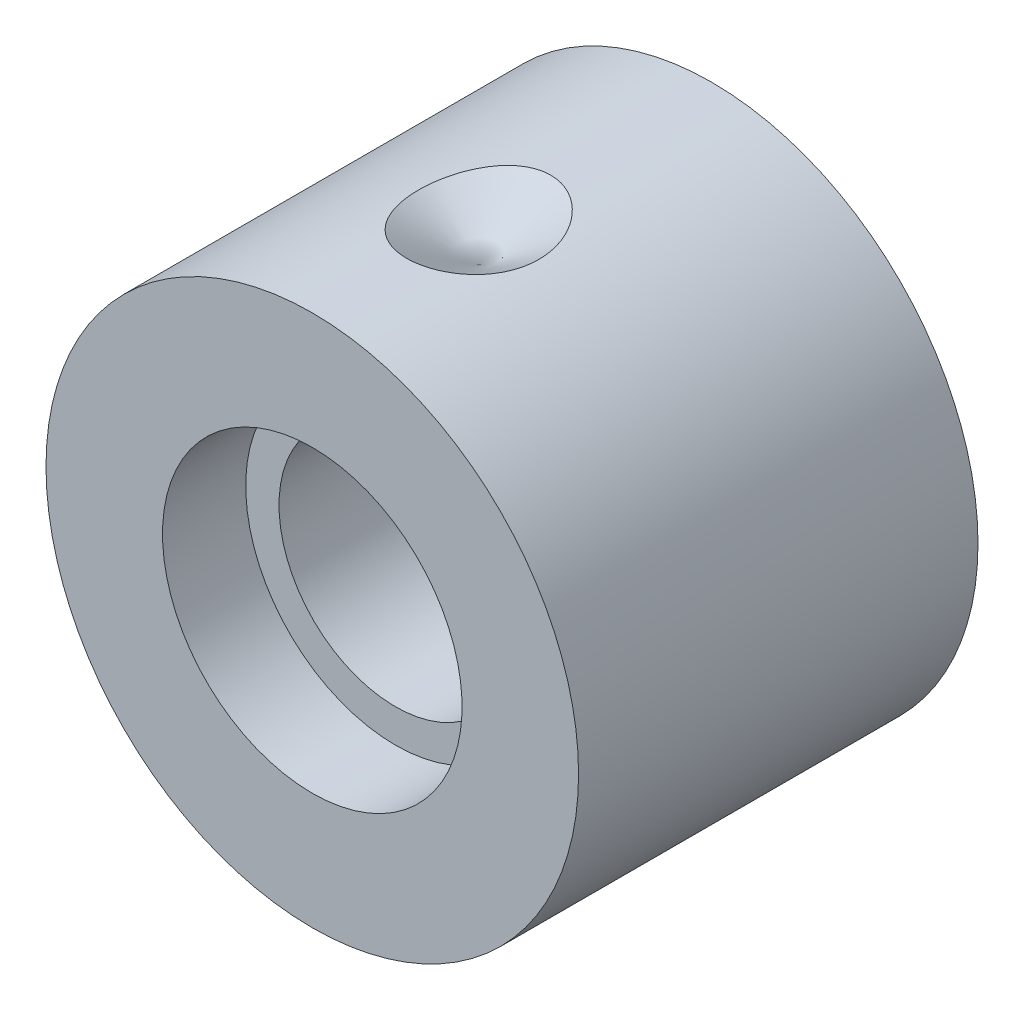
from build123d import *

# Parameters (mm, degrees)
HOLE_WIZARD_M16_1_D = 14


with BuildPart() as part:
    # 草圖1 → 旋轉1 (revolve)
    with BuildSketch(Plane(origin=(0, 0, 0), x_dir=(0, 0, -1), z_dir=(1, 0, 0))):
        Polygon((5, 0), (5, 9), (0, 9), (0, 16), (24, 16), (24, 0), align=None)
    revolve(axis=Axis((0, 0, -24), (0, 0, 1)))

    # 草圖2 → 除料-旋轉1 (revolve, cut)
    with BuildSketch(Plane(origin=(0, 0, 0), x_dir=(0, 0, -1), z_dir=(1, 0, 0))):
        Polygon((3.7183072, 19.324474935), (10, 19.324474935), (10, 13.5), (3.7183072, 17.126737029), align=None)
    revolve(axis=Axis((0, 11.187716982, -10), (0, 1, 0)), mode=Mode.SUBTRACT)

    # M16 螺紋孔1 (through all)
    with Locations(Plane.XY.offset(-5)):
        with Locations((0, 0)):
            Hole(HOLE_WIZARD_M16_1_D / 2)


solid = part.part
